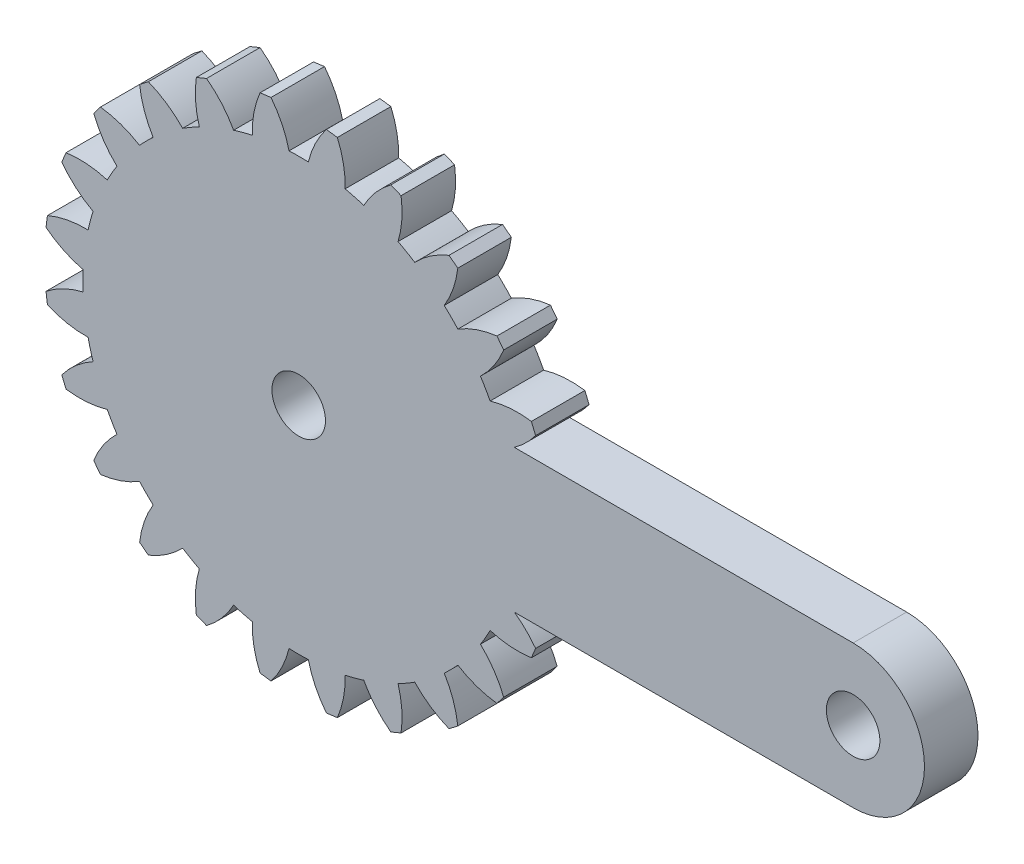
from build123d import *

# Parameters (mm, degrees)
SKETCH1_R           = 1.5
BOSS_EXTRUDE1_DEPTH = 3


with BuildPart() as part:
    # Sketch1 → Boss-Extrude1 (new body)
    with BuildSketch(Plane.XY):
        with BuildLine():
            ThreePointArc((-0.08, 4), (-0.080376511, 3.999992452), (-0.080753021, 3.999984869))
            ThreePointArc((-0.080753021, 3.999984869), (0.560266414, 4.536513248), (1.110799577, 5.165545722))
            Line((1.110799577, 5.165545722), (0.873535849, 5.738351032))
            ThreePointArc((0.873535849, 5.738351032), (-0.292204471, 5.779997685), (-1.43969018, 5.570327744))
            ThreePointArc((-1.43969018, 5.570327744), (-1.699752868, 6.045), (-1.980799756, 6.507557022))
            ThreePointArc((-1.980799756, 6.507557022), (-1.225477407, 7.396473826), (-0.678674306, 8.426857884))
            Line((-0.678674306, 8.426857884), (-1.056106392, 8.918736955))
            ThreePointArc((-1.056106392, 8.918736955), (-2.192904021, 8.657248736), (-3.247023529, 8.15773197))
            ThreePointArc((-3.247023529, 8.15773197), (-3.621079015, 8.548920985), (-4.01226803, 8.922976471))
            ThreePointArc((-4.01226803, 8.922976471), (-3.512751264, 9.977095979), (-3.251263045, 11.113893608))
            Line((-3.251263045, 11.113893608), (-3.743142116, 11.491325694))
            ThreePointArc((-3.743142116, 11.491325694), (-4.773526174, 10.944522593), (-5.662442978, 10.189200244))
            ThreePointArc((-5.662442978, 10.189200244), (-6.125, 10.470247132), (-6.599672256, 10.73030982))
            ThreePointArc((-6.599672256, 10.73030982), (-6.390002315, 11.877795529), (-6.431648968, 13.043535849))
            Line((-6.431648968, 13.043535849), (-7.004454278, 13.280799577))
            ThreePointArc((-7.004454278, 13.280799577), (-7.858205794, 12.485945322), (-8.521341684, 11.526291359))
            ThreePointArc((-8.521341684, 11.526291359), (-9.040877745, 11.67804324), (-9.566685112, 11.806390286))
            ThreePointArc((-9.566685112, 11.806390286), (-9.661150657, 12.969042942), (-10.003094031, 14.084282677))
            Line((-10.003094031, 14.084282677), (-10.617789845, 14.165208916))
            ThreePointArc((-10.617789845, 14.165208916), (-11.236727065, 13.176471511), (-11.628890424, 12.077884766))
            ThreePointArc((-11.628890424, 12.077884766), (-12.17, 12.09), (-12.711109576, 12.077884766))
            ThreePointArc((-12.711109576, 12.077884766), (-13.103272935, 13.176471511), (-13.722210155, 14.165208916))
            Line((-13.722210155, 14.165208916), (-14.336905969, 14.084282677))
            ThreePointArc((-14.336905969, 14.084282677), (-14.678849343, 12.969042942), (-14.773314888, 11.806390286))
            ThreePointArc((-14.773314888, 11.806390286), (-15.299122255, 11.67804324), (-15.818658316, 11.526291359))
            ThreePointArc((-15.818658316, 11.526291359), (-16.481794206, 12.485945322), (-17.335545722, 13.280799577))
            Line((-17.335545722, 13.280799577), (-17.908351032, 13.043535849))
            ThreePointArc((-17.908351032, 13.043535849), (-17.949997685, 11.877795529), (-17.740327744, 10.73030982))
            ThreePointArc((-17.740327744, 10.73030982), (-18.215, 10.470247132), (-18.677557022, 10.189200244))
            ThreePointArc((-18.677557022, 10.189200244), (-19.566473826, 10.944522593), (-20.596857884, 11.491325694))
            Line((-20.596857884, 11.491325694), (-21.088736955, 11.113893608))
            ThreePointArc((-21.088736955, 11.113893608), (-20.827248736, 9.977095979), (-20.32773197, 8.922976471))
            ThreePointArc((-20.32773197, 8.922976471), (-20.718920985, 8.548920985), (-21.092976471, 8.15773197))
            ThreePointArc((-21.092976471, 8.15773197), (-22.147095979, 8.657248736), (-23.283893608, 8.918736955))
            Line((-23.283893608, 8.918736955), (-23.661325694, 8.426857884))
            ThreePointArc((-23.661325694, 8.426857884), (-23.114522593, 7.396473826), (-22.359200244, 6.507557022))
            ThreePointArc((-22.359200244, 6.507557022), (-22.640247132, 6.045), (-22.90030982, 5.570327744))
            ThreePointArc((-22.90030982, 5.570327744), (-24.047795529, 5.779997685), (-25.213535849, 5.738351032))
            Line((-25.213535849, 5.738351032), (-25.450799577, 5.165545722))
            ThreePointArc((-25.450799577, 5.165545722), (-24.655945322, 4.311794206), (-23.696291359, 3.648658316))
            ThreePointArc((-23.696291359, 3.648658316), (-23.84804324, 3.129122255), (-23.976390286, 2.603314888))
            ThreePointArc((-23.976390286, 2.603314888), (-25.139042942, 2.508849343), (-26.254282677, 2.166905969))
            Line((-26.254282677, 2.166905969), (-26.335208916, 1.552210155))
            ThreePointArc((-26.335208916, 1.552210155), (-25.346471511, 0.933272935), (-24.247884766, 0.541109576))
            ThreePointArc((-24.247884766, 0.541109576), (-24.26, 0), (-24.247884766, -0.541109576))
            ThreePointArc((-24.247884766, -0.541109576), (-25.346471511, -0.933272935), (-26.335208916, -1.552210155))
            Line((-26.335208916, -1.552210155), (-26.254282677, -2.166905969))
            ThreePointArc((-26.254282677, -2.166905969), (-25.139042942, -2.508849343), (-23.976390286, -2.603314888))
            ThreePointArc((-23.976390286, -2.603314888), (-23.84804324, -3.129122255), (-23.696291359, -3.648658316))
            ThreePointArc((-23.696291359, -3.648658316), (-24.655945322, -4.311794206), (-25.450799577, -5.165545722))
            Line((-25.450799577, -5.165545722), (-25.213535849, -5.738351032))
            ThreePointArc((-25.213535849, -5.738351032), (-24.047795529, -5.779997685), (-22.90030982, -5.570327744))
            ThreePointArc((-22.90030982, -5.570327744), (-22.640247132, -6.045), (-22.359200244, -6.507557022))
            ThreePointArc((-22.359200244, -6.507557022), (-23.114522593, -7.396473826), (-23.661325694, -8.426857884))
            Line((-23.661325694, -8.426857884), (-23.283893608, -8.918736955))
            ThreePointArc((-23.283893608, -8.918736955), (-22.147095979, -8.657248736), (-21.092976471, -8.15773197))
            ThreePointArc((-21.092976471, -8.15773197), (-20.718920985, -8.548920985), (-20.32773197, -8.922976471))
            ThreePointArc((-20.32773197, -8.922976471), (-20.827248736, -9.977095979), (-21.088736955, -11.113893608))
            Line((-21.088736955, -11.113893608), (-20.596857884, -11.491325694))
            ThreePointArc((-20.596857884, -11.491325694), (-19.566473826, -10.944522593), (-18.677557022, -10.189200244))
            ThreePointArc((-18.677557022, -10.189200244), (-18.215, -10.470247132), (-17.740327744, -10.73030982))
            ThreePointArc((-17.740327744, -10.73030982), (-17.949997685, -11.877795529), (-17.908351032, -13.043535849))
            Line((-17.908351032, -13.043535849), (-17.335545722, -13.280799577))
            ThreePointArc((-17.335545722, -13.280799577), (-16.481794206, -12.485945322), (-15.818658316, -11.526291359))
            ThreePointArc((-15.818658316, -11.526291359), (-15.299122255, -11.67804324), (-14.773314888, -11.806390286))
            ThreePointArc((-14.773314888, -11.806390286), (-14.678849343, -12.969042942), (-14.336905969, -14.084282677))
            Line((-14.336905969, -14.084282677), (-13.722210155, -14.165208916))
            ThreePointArc((-13.722210155, -14.165208916), (-13.103272935, -13.176471511), (-12.711109576, -12.077884766))
            ThreePointArc((-12.711109576, -12.077884766), (-12.17, -12.09), (-11.628890424, -12.077884766))
            ThreePointArc((-11.628890424, -12.077884766), (-11.236727065, -13.176471511), (-10.617789845, -14.165208916))
            Line((-10.617789845, -14.165208916), (-10.003094031, -14.084282677))
            ThreePointArc((-10.003094031, -14.084282677), (-9.661150657, -12.969042942), (-9.566685112, -11.806390286))
            ThreePointArc((-9.566685112, -11.806390286), (-9.040877745, -11.67804324), (-8.521341684, -11.526291359))
            ThreePointArc((-8.521341684, -11.526291359), (-7.858205794, -12.485945322), (-7.004454278, -13.280799577))
            Line((-7.004454278, -13.280799577), (-6.431648968, -13.043535849))
            ThreePointArc((-6.431648968, -13.043535849), (-6.390002315, -11.877795529), (-6.599672256, -10.73030982))
            ThreePointArc((-6.599672256, -10.73030982), (-6.125, -10.470247132), (-5.662442978, -10.189200244))
            ThreePointArc((-5.662442978, -10.189200244), (-4.773526174, -10.944522593), (-3.743142116, -11.491325694))
            Line((-3.743142116, -11.491325694), (-3.251263045, -11.113893608))
            ThreePointArc((-3.251263045, -11.113893608), (-3.512751264, -9.977095979), (-4.01226803, -8.922976471))
            ThreePointArc((-4.01226803, -8.922976471), (-3.621079015, -8.548920985), (-3.247023529, -8.15773197))
            ThreePointArc((-3.247023529, -8.15773197), (-2.192904021, -8.657248736), (-1.056106392, -8.918736955))
            Line((-1.056106392, -8.918736955), (-0.678674306, -8.426857884))
            ThreePointArc((-0.678674306, -8.426857884), (-1.225477407, -7.396473826), (-1.980799756, -6.507557022))
            ThreePointArc((-1.980799756, -6.507557022), (-1.699752868, -6.045), (-1.43969018, -5.570327744))
            ThreePointArc((-1.43969018, -5.570327744), (-0.292204471, -5.779997685), (0.873535849, -5.738351032))
            Line((0.873535849, -5.738351032), (1.110799577, -5.165545722))
            ThreePointArc((1.110799577, -5.165545722), (0.560266414, -4.536513248), (-0.080753021, -3.999984869))
            ThreePointArc((-0.080753021, -3.999984869), (-0.080376511, -3.999992452), (-0.08, -4))
            Line((-0.08, -4), (18.91, -4))
            ThreePointArc((18.91, -4), (22.91, 0), (18.91, 4))
            Line((18.91, 4), (-0.08, 4))
        make_face()
        with Locations((18.91, 0)):
            Circle(SKETCH1_R, mode=Mode.SUBTRACT)
        with Locations((-12.17, 0)):
            Circle(SKETCH1_R, mode=Mode.SUBTRACT)
    extrude(amount=BOSS_EXTRUDE1_DEPTH)


solid = part.part
